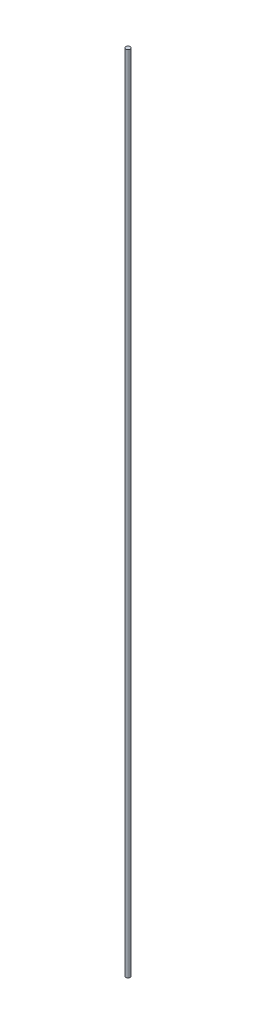
from build123d import *

# Parameters (mm, degrees)
SKETCH1_R           = 2
BOSS_EXTRUDE2_DEPTH = 700


with BuildPart() as part:
    # Sketch1 → Boss-Extrude2 (new body)
    with BuildSketch(Plane(origin=(0, 0, 0), x_dir=(1, 0, 0), z_dir=(0, 1, 0))):
        with Locations(Location((0, 0, 0), (0, 0, 270))):
            Circle(SKETCH1_R)
    extrude(amount=BOSS_EXTRUDE2_DEPTH)


solid = part.part
